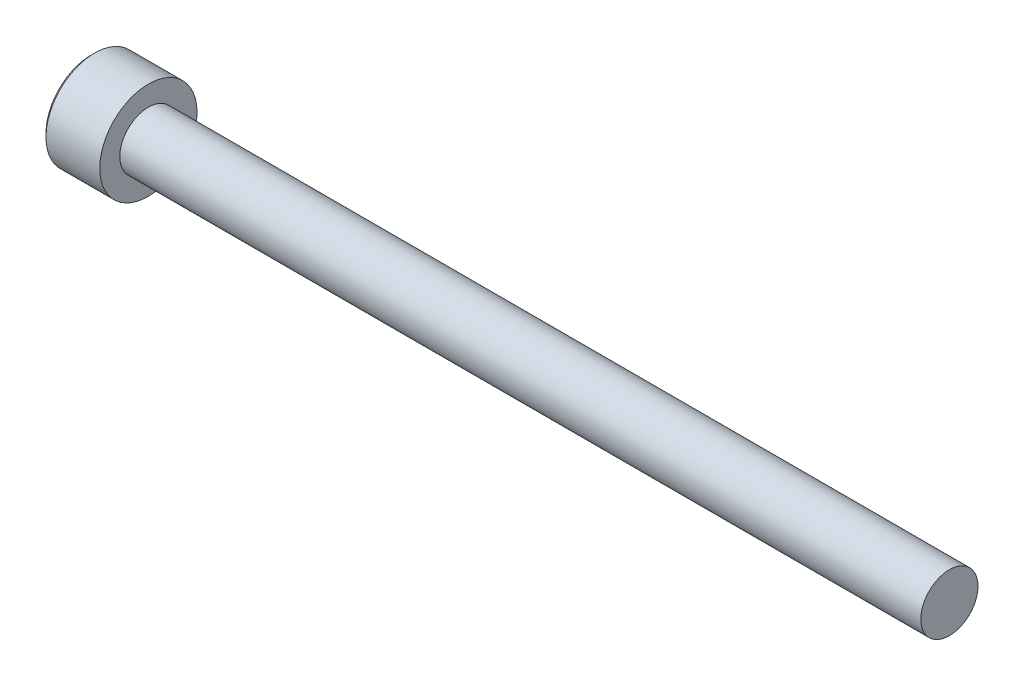
from build123d import *

# Parameters (mm, degrees)
CUT_EXTRUDE1_DEPTH = 2.5


with BuildPart() as part:
    # Sketch1 → Revolve1 (revolve)
    with BuildSketch(Plane.XY, mode=Mode.PRIVATE) as revolve1_sk:
        Polygon((-5, 0), (-5, 3.95), (-4.7, 4.25), (0, 4.25), (0, 2.5), (70, 2.5), (70, 0), align=None)
    revolve(revolve1_sk.sketch.rotate(Axis((-5, 0, 0), (1, 0, 0)), 180), axis=Axis((-5, 0, 0), (1, 0, 0)))

    # Sketch2 → Cut-Extrude1 (cut)
    with BuildSketch(Plane.ZY.offset(5)):
        Polygon((0, 2.309401077), (-2, 1.154700538), (-2, -1.154700538), (0, -2.309401077), (2, -1.154700538), (2, 1.154700538), align=None)
    extrude(amount=-CUT_EXTRUDE1_DEPTH, mode=Mode.SUBTRACT)

    # Sketch3 → Cut-Revolve1 (revolve, cut)
    with BuildSketch(Plane.XY, mode=Mode.PRIVATE) as cut_revolve1_sk:
        Polygon((-2.5, 0), (-2.5, 2), (-1.298278762, 0), align=None)
    revolve(cut_revolve1_sk.sketch.rotate(Axis((-2.5, 0, 0), (1, 0, 0)), 180), axis=Axis((-2.5, 0, 0), (1, 0, 0)), mode=Mode.SUBTRACT)


solid = part.part
